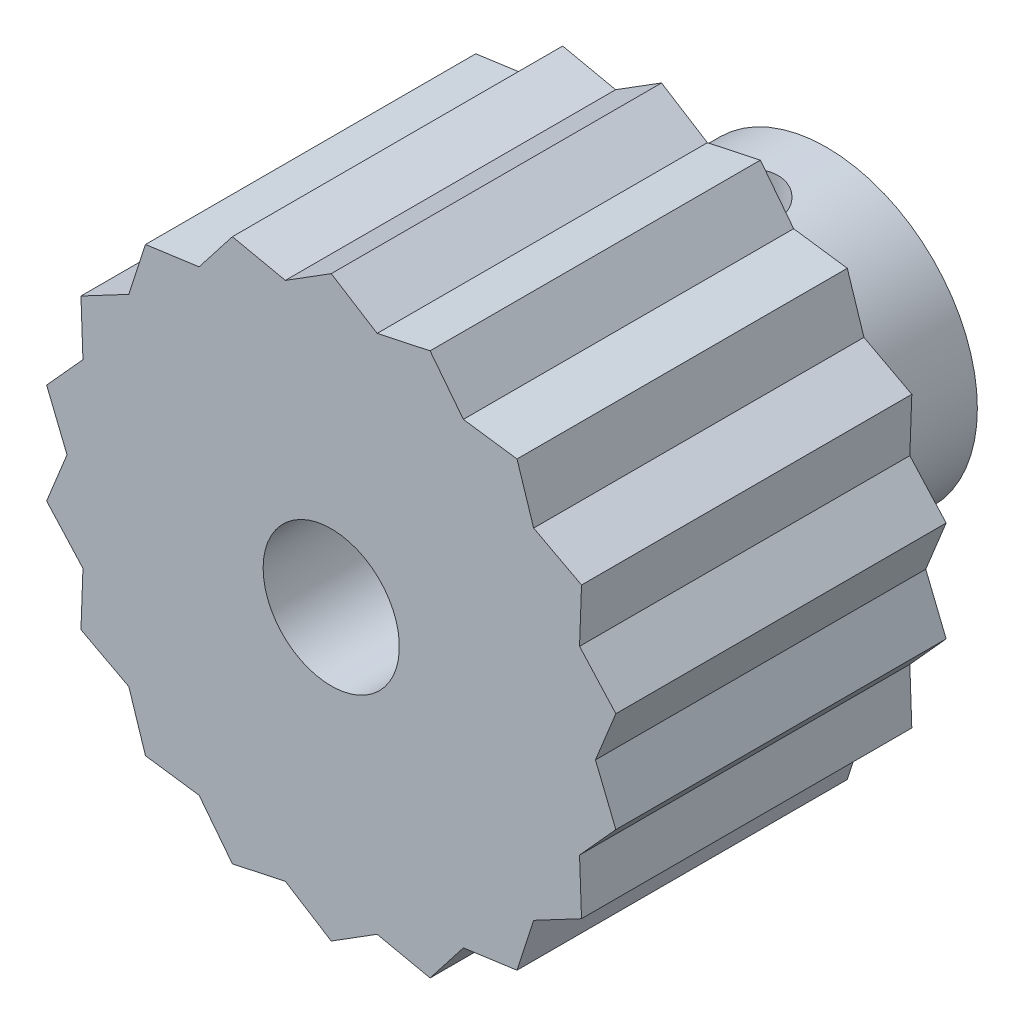
from build123d import *

# Parameters (mm, degrees)
CROQUIS1_R                 = 17.5
SALIENTE_EXTRUIR1_DEPTH    = 20
CROQUIS2_R                 = 9.125
CROQUIS2_R_2               = 4.125
SALIENTE_EXTRUIR2_DEPTH    = 10
CORTAR_EXTRUIR1_START      = -20
CROQUIS3_R                 = 19
CORTAR_EXTRUIR1_DEPTH      = 20
CORTAR_EXTRUIR2_DEPTH      = 32.674365543
CORTAR_EXTRUIR2_DEPTH_BACK = 32.674365543
CROQUIS4_R                 = 2.05
CROQUIS5_R                 = 4.125
CORTAR_EXTRUIR3_DEPTH      = 32.674365543


with BuildPart() as part:
    # Croquis1 → Saliente-Extruir1 (new body)
    with BuildSketch(Plane.XY):
        Circle(CROQUIS1_R)
    extrude(amount=SALIENTE_EXTRUIR1_DEPTH)

    # Croquis2 → Saliente-Extruir2 (add)
    with BuildSketch(Plane(origin=(0, 0, 0), x_dir=(-1, 0, 0), z_dir=(0, 0, -1))):
        with Locations(Location((0, 0, 0), (0, 0, 180))):
            Circle(CROQUIS2_R)
        Circle(CROQUIS2_R_2, mode=Mode.SUBTRACT)
    extrude(amount=SALIENTE_EXTRUIR2_DEPTH)

    # Croquis3 → Cortar-Extruir1 (cut)
    with BuildSketch(Plane.XY.offset(20).offset(CORTAR_EXTRUIR1_START)):
        Circle(CROQUIS3_R)
        Polygon((0, 17.5), (2.778370843, 15.756924048), (5.985352508, 16.444620864), (8, 13.856406461), (11.24878317, 13.405777755), (12.25671109, 10.284601755), (15.155444566, 8.75), (15.035081933, 5.472322293), (17.234135678, 3.038843109), (16, 0), (17.234135678, -3.038843109), (15.035081933, -5.472322293), (15.155444566, -8.75), (12.25671109, -10.284601755), (11.24878317, -13.405777755), (8, -13.856406461), (5.985352508, -16.444620864), (2.778370843, -15.756924048), (0, -17.5), (-2.778370843, -15.756924048), (-5.985352508, -16.444620864), (-8, -13.856406461), (-11.24878317, -13.405777755), (-12.25671109, -10.284601755), (-15.155444566, -8.75), (-15.035081933, -5.472322293), (-17.234135678, -3.038843109), (-16, 0), (-17.234135678, 3.038843109), (-15.035081933, 5.472322293), (-15.155444566, 8.75), (-12.25671109, 10.284601755), (-11.24878317, 13.405777755), (-8, 13.856406461), (-5.985352508, 16.444620864), (-2.778370843, 15.756924048), align=None, mode=Mode.SUBTRACT)
    extrude(amount=CORTAR_EXTRUIR1_DEPTH, mode=Mode.SUBTRACT)

    # Croquis4 → Cortar-Extruir2 (cut, two sides: drawn at the far end of the back side and taken through both)
    with BuildSketch(Plane(origin=(0, 0, 0), x_dir=(1, 0, 0), z_dir=(0, 1, 0)).offset(-CORTAR_EXTRUIR2_DEPTH_BACK)):
        with Locations(Location((0, 5, 0), (0, 0, 270))):
            Circle(CROQUIS4_R)
    extrude(amount=CORTAR_EXTRUIR2_DEPTH + CORTAR_EXTRUIR2_DEPTH_BACK, mode=Mode.SUBTRACT)

    # Croquis5 → Cortar-Extruir3 (cut, through all)
    with BuildSketch(Plane(origin=(0, 0, 0), x_dir=(-1, 0, 0), z_dir=(0, 0, -1))):
        Circle(CROQUIS5_R)
    extrude(amount=-CORTAR_EXTRUIR3_DEPTH, mode=Mode.SUBTRACT)


solid = part.part
